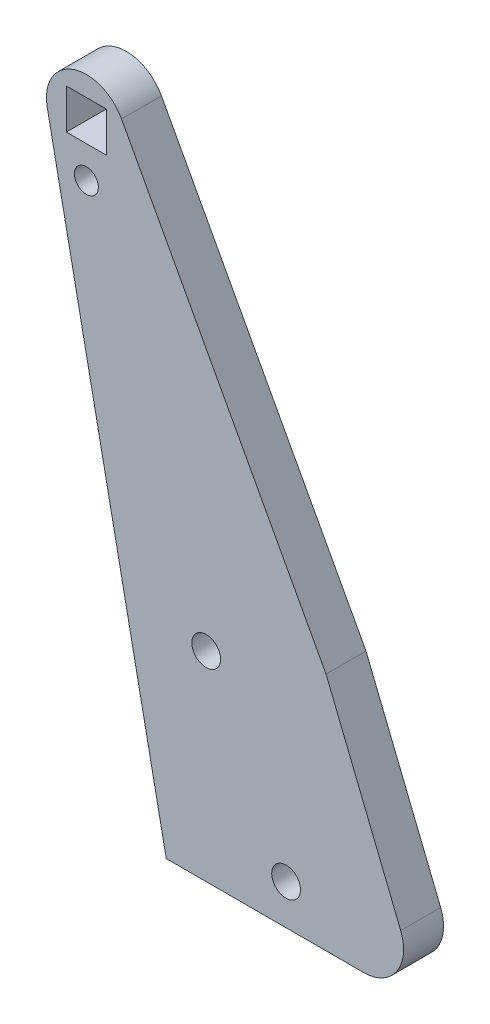
from build123d import *

# Parameters (mm, degrees)
SKETCH1_R           = 2.286
SKETCH1_R_2         = 1.905
SKETCH1_W           = 6.35
SKETCH1_H           = 6.35
BOSS_EXTRUDE1_DEPTH = 6.35
FILLET1_R           = 6.35


with BuildPart() as part:
    # Sketch1 → Boss-Extrude1 (new body)
    with BuildSketch(Plane.XY):
        with BuildLine():
            Line((0, 0), (-25.4, 0))
            Line((-25.4, 0), (-44.325080611, 93.996655919))
            ThreePointArc((-44.325080611, 93.996655919), (-40.259800646, 101.221411991), (-32.513467201, 98.268799644))
            Line((-32.513467201, 98.268799644), (0, 38.1))
            Line((0, 38.1), (15.393399204, 0))
            Line((15.393399204, 0), (0, 0))
        make_face()
        with Locations((-6.35, 6.35)):
            Circle(SKETCH1_R, mode=Mode.SUBTRACT)
        with Locations((-19.05, 31.75)):
            Circle(SKETCH1_R, mode=Mode.SUBTRACT)
        with Locations((-38.1, 86.995)):
            Circle(SKETCH1_R_2, mode=Mode.SUBTRACT)
        with Locations((-38.1, 95.25)):
            Rectangle(SKETCH1_W, SKETCH1_H, mode=Mode.SUBTRACT)
    extrude(amount=-BOSS_EXTRUDE1_DEPTH)

    # Fillet1
    fillet1_edges = [part.edges().sort_by_distance(p)[0] for p in [
        (15.393399204, 0, -3.175),
    ]]
    fillet(fillet1_edges, radius=FILLET1_R)


solid = part.part
